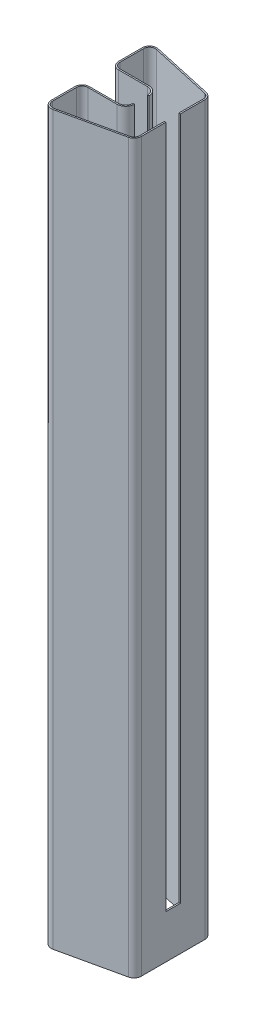
from build123d import *

# Parameters (mm, degrees)
BOSS_EXTRUDE1_DEPTH = 100
FILLET1_R           = 1
SHELL3_T            = -0.2
SKETCH2_W           = 5.995745437
SKETCH2_H           = 2
CUT_EXTRUDE1_DEPTH  = 94


with BuildPart() as part:
    # Sketch1 → Boss-Extrude1 (new body)
    with BuildSketch(Plane(origin=(0, 0, 0), x_dir=(1, 0, 0), z_dir=(0, 1, 0))):
        Polygon((62.497660956, -33.372417048), (51.997660956, -31.04462309), (51.997660956, -36.54462309), (57.997660956, -36.54462309), (57.997660956, -40.54462309), (51.997660956, -40.54462309), (51.997660956, -46.04462309), (62.497660956, -43.716829132), align=None)
    extrude(amount=BOSS_EXTRUDE1_DEPTH)

    # Fillet1
    fillet1_edges = [part.edges().sort_by_distance(p)[0] for p in [
        (62.497660956, 50, 43.716829132),
        (51.997660956, 50, 46.04462309),
        (51.997660956, 50, 40.54462309),
        (57.997660956, 50, 40.54462309),
        (57.997660956, 50, 36.54462309),
        (51.997660956, 50, 36.54462309),
        (51.997660956, 50, 31.04462309),
        (62.497660956, 50, 33.372417048),
    ]]
    fillet(fillet1_edges, radius=FILLET1_R)

    # Shell3
    shell3_openings = [part.faces().sort_by_distance(p)[0] for p in [
        (57.425338322, 100, 32.431348777),
        (57.425338322, 0, 32.431348777),
    ]]
    offset(amount=SHELL3_T, openings=shell3_openings, kind=Kind.INTERSECTION)

    # Sketch2 → Cut-Extrude1 (cut)
    with BuildSketch(Plane(origin=(0, 100, 0), x_dir=(1, 0, 0), z_dir=(0, 1, 0))):
        with Locations((60.442884904, -38.54462309)):
            Rectangle(SKETCH2_W, SKETCH2_H)
    extrude(amount=-CUT_EXTRUDE1_DEPTH, mode=Mode.SUBTRACT)


solid = part.part
